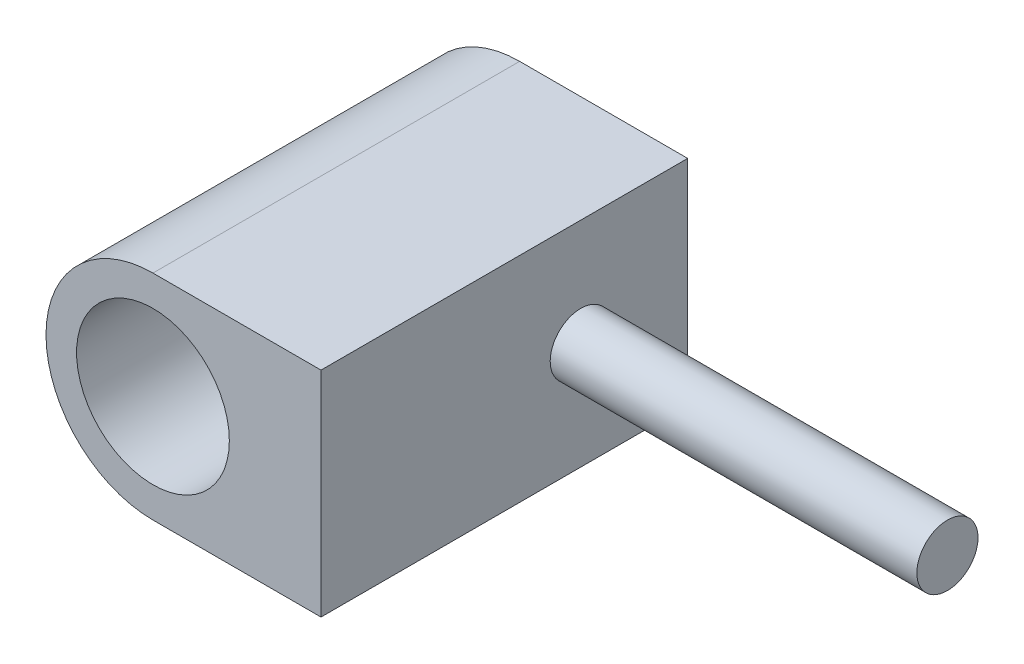
from build123d import *

# Parameters (mm, degrees)
SKETCH1_R           = 20
BOSS_EXTRUDE1_DEPTH = 120
SKETCH2_R           = 25
CUT_EXTRUDE1_DEPTH  = 110
SKETCH3_R           = 10
BOSS_EXTRUDE2_DEPTH = 120


with BuildPart() as part:
    # Sketch1 → Boss-Extrude1 (new body)
    with BuildSketch(Plane.XY):
        with BuildLine():
            Line((0, 0), (-55, 0))
            ThreePointArc((-55, 0), (-90, 35), (-55, 70))
            Line((-55, 70), (0, 70))
            Line((0, 70), (0, 0))
        make_face()
        with Locations((-55, 35)):
            Circle(SKETCH1_R, mode=Mode.SUBTRACT)
    extrude(amount=BOSS_EXTRUDE1_DEPTH)

    # Sketch2 → Cut-Extrude1 (cut)
    with BuildSketch(Plane.XY.offset(120)):
        with Locations((-55, 35)):
            Circle(SKETCH2_R)
    extrude(amount=-CUT_EXTRUDE1_DEPTH, mode=Mode.SUBTRACT)

    # Sketch3 → Boss-Extrude2 (add)
    with BuildSketch(Plane(origin=(0, 0, 0), x_dir=(0, 0, -1), z_dir=(1, 0, 0))):
        with Locations(Location((-35, 35, 0), (0, 0, 180))):
            Circle(SKETCH3_R)
    extrude(amount=BOSS_EXTRUDE2_DEPTH)


solid = part.part
